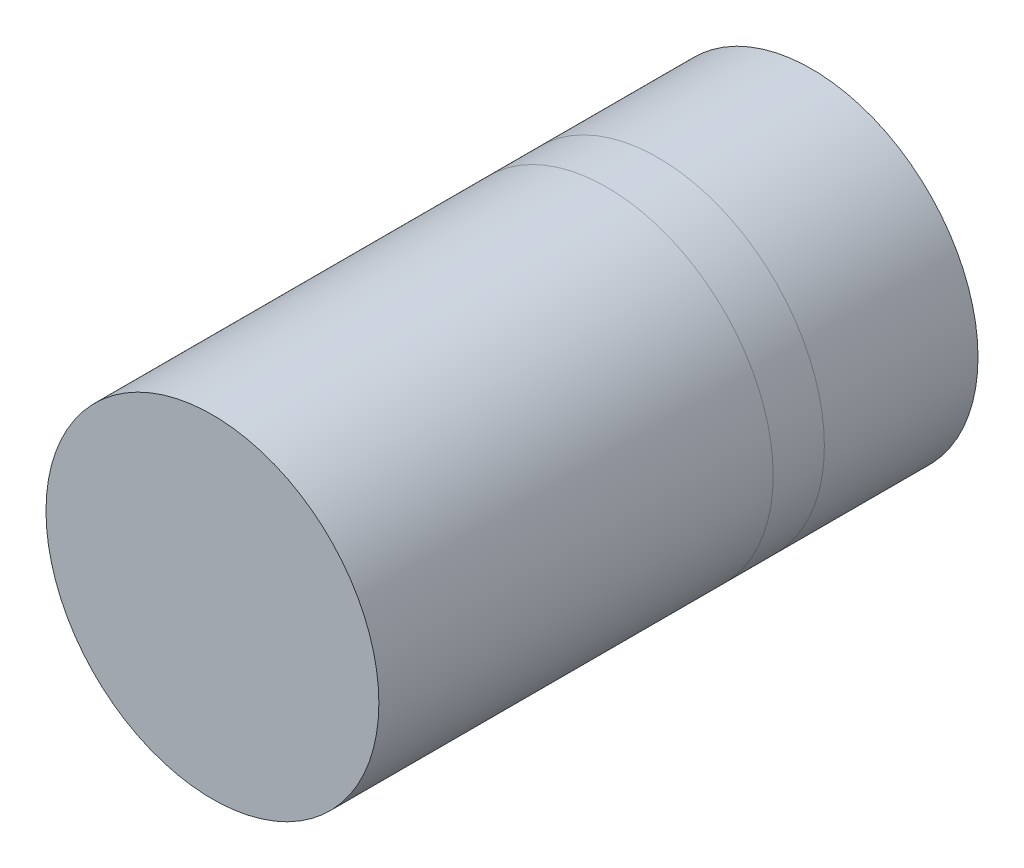
from build123d import *

# Parameters (mm, degrees)
SKETCH1_R         = 65
EXTRUDEASSE_DEPTH = 234


with BuildPart() as part:
    # Sketch1 → ExtrudeAsse (new body)
    with BuildSketch(Plane.XY):
        Circle(SKETCH1_R)
    extrude(amount=EXTRUDEASSE_DEPTH)


solid = part.part
